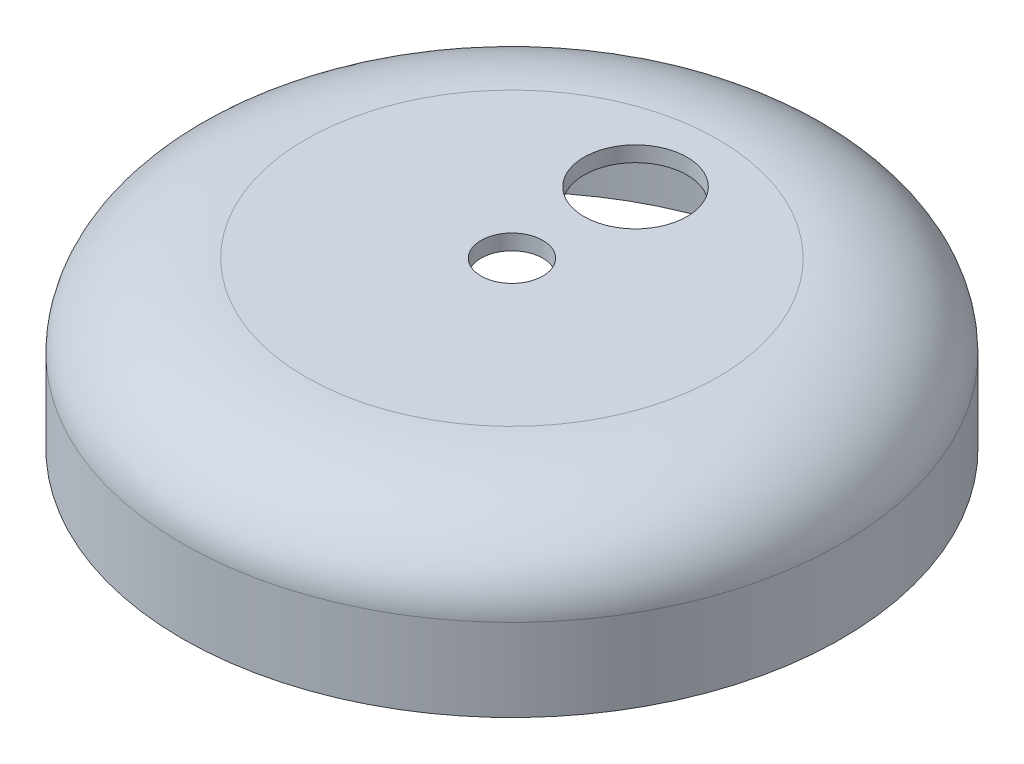
from build123d import *

# Parameters (mm, degrees)
SKETCH2_R          = 15.875
SKETCH2_R_2        = 9.525
CUT_EXTRUDE1_DEPTH = 25.4


with BuildPart() as part:
    # Sketch1 → Revolve1 (revolve)
    with BuildSketch(Plane.XY, mode=Mode.PRIVATE) as revolve1_sk:
        with BuildLine():
            Line((0, 0), (0, -4.7625))
            Line((0, -4.7625), (63.5, -4.7625))
            add(Edge.make_bspline(
                [(96.8375, -25.4), (96.8375, -4.7625), (63.5, -4.7625)],
                knots=[0, 0, 0, 1.570796327, 1.570796327, 1.570796327], degree=2, weights=[1, 0.707106781, 1]))
            Line((96.8375, -25.4), (96.8375, -50.8))
            Line((96.8375, -50.8), (101.6, -50.8))
            Line((101.6, -50.8), (101.6, -25.4))
            add(Edge.make_bspline(
                [(101.6, -25.4), (101.6, 0), (63.5, 0)],
                knots=[3.141592654, 3.141592654, 3.141592654, 4.71238898, 4.71238898, 4.71238898], degree=2, weights=[1, 0.707106781, 1]))
            Line((63.5, 0), (0, 0))
        make_face()
    revolve(revolve1_sk.sketch.rotate(Axis((0, 29.511089747, 0), (0, -1, 0)), 90), axis=Axis((0, 29.511089747, 0), (0, -1, 0)))

    # Sketch2 → Cut-Extrude1 (cut)
    with BuildSketch(Plane(origin=(0, 0, 0), x_dir=(1, 0, 0), z_dir=(0, 1, 0))):
        with Locations(Location((0, 38.1, 0), (0, 0, 270))):
            Circle(SKETCH2_R)
        with Locations(Location((0, 0, 0), (0, 0, 270))):
            Circle(SKETCH2_R_2)
    extrude(amount=-CUT_EXTRUDE1_DEPTH, mode=Mode.SUBTRACT)


solid = part.part
